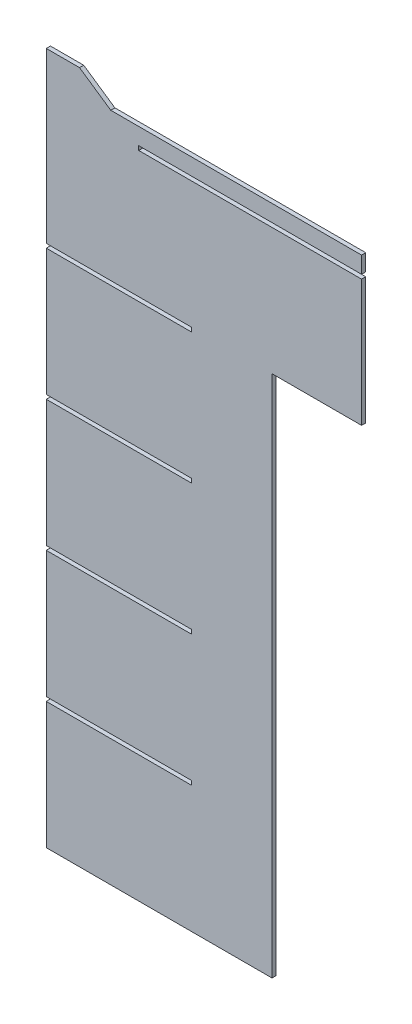
from build123d import *

# Parameters (mm, degrees)
BOSS_EXTRUDE2_DEPTH = 3.175
SKETCH2_W           = 24.39416
SKETCH2_H           = 495.5921
BOSS_EXTRUDE3_DEPTH = 3.175
BOSS_EXTRUDE4_DEPTH = 3.175
SKETCH4_W           = 68.31584
SKETCH4_H           = 12.7
SKETCH4_H_2         = 96.57842
BOSS_EXTRUDE5_DEPTH = 3.175


with BuildPart() as part:
    # Sketch1 → Boss-Extrude2 (new body)
    with BuildSketch(Plane.XY):
        Polygon((129.013076168, 254.245404572), (-18.685383832, 254.245404572), (-18.685383832, 157.666984572), (92.088461168, 157.666984572), (92.088461168, 154.491984572), (-18.685383832, 154.491984572), (-18.685383832, 57.913564572), (92.088461168, 57.913564572), (92.088461168, 54.738564572), (-18.685383832, 54.738564572), (-18.685383832, -41.839855428), (92.088461168, -41.839855428), (92.088461168, -45.014855428), (-18.685383832, -45.014855428), (-18.685383832, -141.593275428), (92.088461168, -141.593275428), (92.088461168, -144.768275428), (-18.685383832, -144.768275428), (-18.685383832, -241.346695428), (129.013076168, -241.346695428), align=None)
    extrude(amount=BOSS_EXTRUDE2_DEPTH)

    # Sketch2 → Boss-Extrude3 (add, through all)
    with BuildSketch(Plane.XY.offset(3.175)):
        with Locations((141.210156168, 6.449354572)):
            Rectangle(SKETCH2_W, SKETCH2_H)
    extrude(amount=-BOSS_EXTRUDE3_DEPTH)

    # Sketch3 → Boss-Extrude4 (add, through all)
    with BuildSketch(Plane.XY.offset(3.175)):
        Polygon((51.807236168, 257.420404572), (51.807236168, 254.245404572), (-18.685383832, 254.245404572), (-18.685383832, 286.376404572), (6.714616168, 286.376404572), (30.496305109, 270.120404572), (153.407236168, 270.120404572), (153.407236168, 257.420404572), align=None)
    extrude(amount=-BOSS_EXTRUDE4_DEPTH)

    # Sketch4 → Boss-Extrude5 (add, through all)
    with BuildSketch(Plane.XY.offset(3.175)):
        with Locations((187.565156168, 263.770404572)):
            Rectangle(SKETCH4_W, SKETCH4_H)
        with Locations((187.565156168, 205.956194572)):
            Rectangle(SKETCH4_W, SKETCH4_H_2)
    extrude(amount=-BOSS_EXTRUDE5_DEPTH)


solid = part.part
